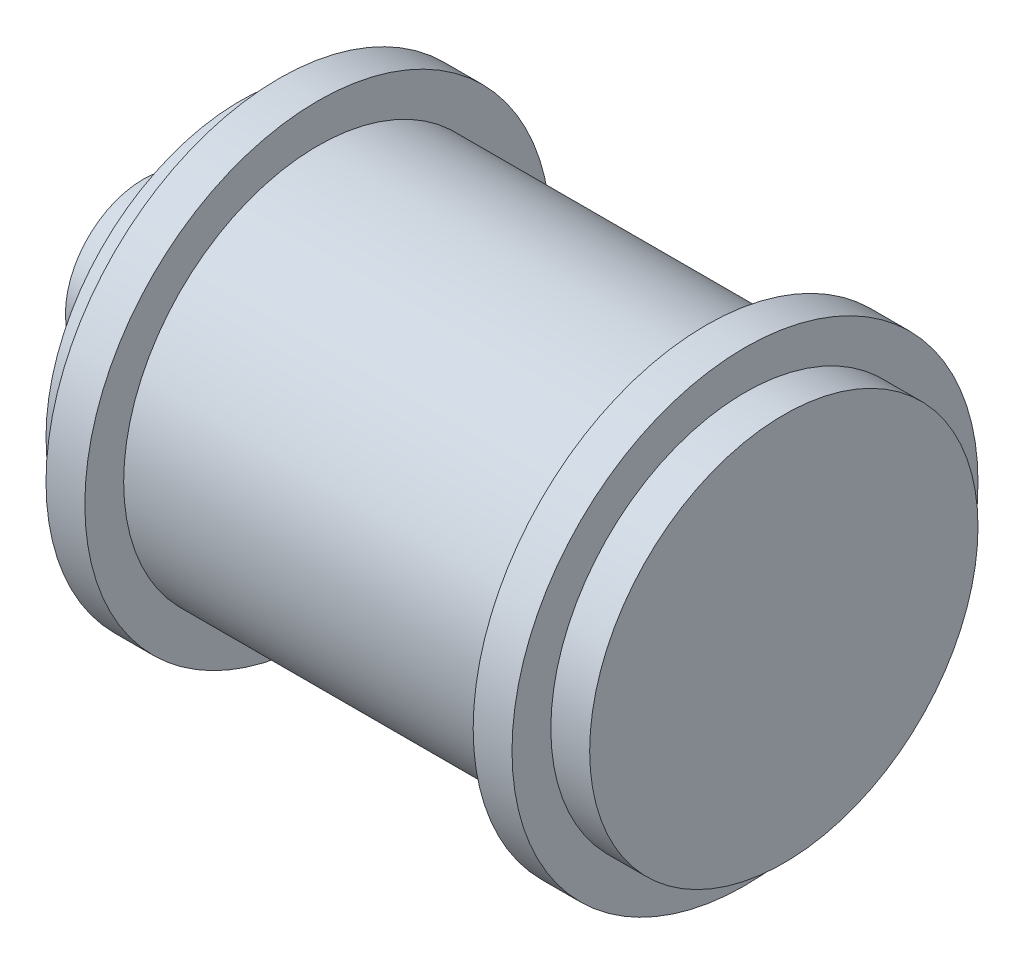
from build123d import *

# Parameters (mm, degrees)
SKETCH1_R               = 50
BOSS_EXTRUDE1_DEPTH     = 140
SKETCH2_W               = 10
SKETCH2_H               = 60
BOSS_EXTRUDE2_START     = 100
SKETCH3_R               = 50
BOSS_EXTRUDE2_DEPTH     = 100
SKETCH4_R               = 169.268161275
BOSS_EXTRUDE3_DEPTH     = 10
FILLET2_R               = 50
CUT_EXTRUDE1_DEPTH      = 278.314660346
CUT_EXTRUDE1_DEPTH_BACK = 278.314660346
SKETCH5_W               = 221.299470988
SKETCH5_H               = 358.524470465


with BuildPart() as part:
    # Sketch1 → Boss-Extrude1 (new body)
    with BuildSketch(Plane(origin=(0, 0, 0), x_dir=(0, 0, -1), z_dir=(1, 0, 0))):
        Circle(SKETCH1_R)
    extrude(amount=BOSS_EXTRUDE1_DEPTH)

    # Sketch2 → Revolve1 (revolve)
    with BuildSketch(Plane(origin=(0, 0, 0), x_dir=(1, 0, 0), z_dir=(0, 1, 0)), mode=Mode.PRIVATE) as revolve1_sk:
        with Locations((15, 30)):
            Rectangle(SKETCH2_W, SKETCH2_H)
        with Locations((125, 30)):
            Rectangle(SKETCH2_W, SKETCH2_H)
    revolve(revolve1_sk.sketch.rotate(Axis((0, 0, 0), (1, 0, 0)), 180), axis=Axis((0, 0, 0), (1, 0, 0)))

    # Sketch3 → Boss-Extrude2 (add)
    with BuildSketch(Plane.ZY.offset(BOSS_EXTRUDE2_START)):
        Circle(SKETCH3_R)
    extrude(amount=-BOSS_EXTRUDE2_DEPTH)

    # Sketch4 → Boss-Extrude3 (add)
    with BuildSketch(Plane.ZY.offset(100)):
        Circle(SKETCH4_R)
    extrude(amount=BOSS_EXTRUDE3_DEPTH)

    # Fillet2
    fillet2_edges = [part.edges().sort_by_distance(p)[0] for p in [
        (-100, 0, -50),
    ]]
    fillet(fillet2_edges, radius=FILLET2_R)

    # Sketch5 → Cut-Extrude1 (cut, two sides: drawn at the far end of the back side and taken through both)
    with BuildSketch(Plane.XY.offset(-CUT_EXTRUDE1_DEPTH_BACK)):
        with Locations((-135.649735494, -5.556646105)):
            Rectangle(SKETCH5_W, SKETCH5_H)
    extrude(amount=CUT_EXTRUDE1_DEPTH + CUT_EXTRUDE1_DEPTH_BACK, mode=Mode.SUBTRACT)

    # Sketch6 → Cut-Revolve1 (revolve, cut)
    with BuildSketch(Plane(origin=(0, 0, 0), x_dir=(1, 0, 0), z_dir=(0, 1, 0)), mode=Mode.PRIVATE) as cut_revolve1_sk:
        Polygon((-37.123590864, 20), (0, 20), (0, 63.419467726), (-45.130639874, 53.302044746), align=None)
    revolve(cut_revolve1_sk.sketch.rotate(Axis((-42.77009101, 0, 0), (1, 0, 0)), 180), axis=Axis((-42.77009101, 0, 0), (1, 0, 0)), mode=Mode.SUBTRACT)


solid = part.part
